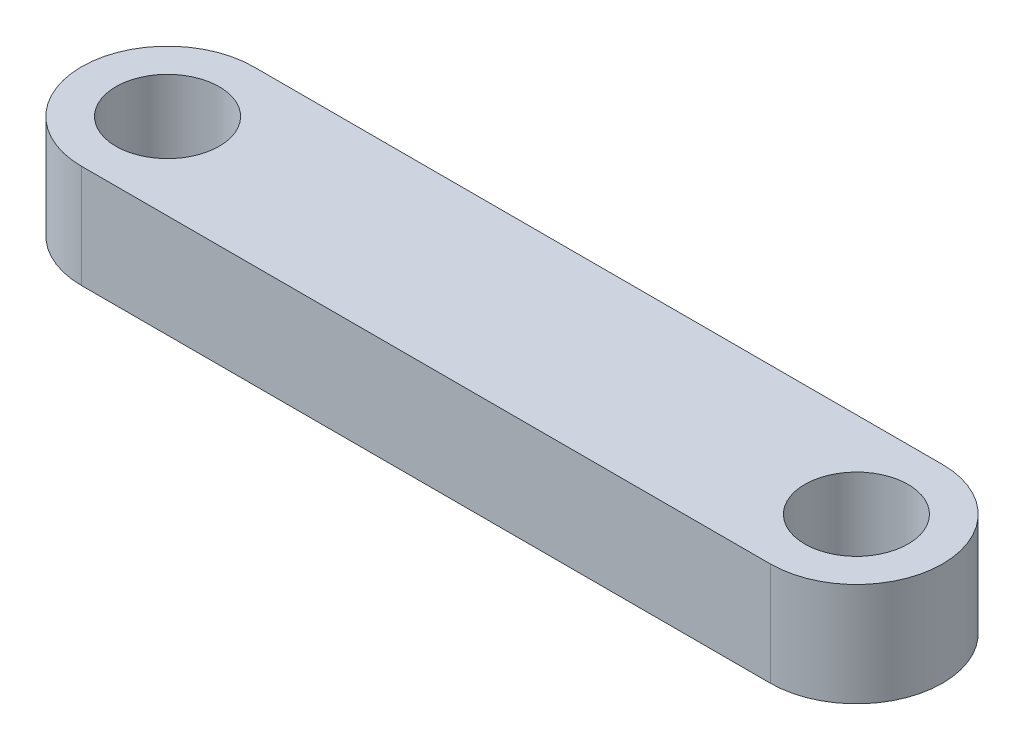
from build123d import *

# Parameters (mm, degrees)
CROQUIS1_R              = 1.5
SALIENTE_EXTRUIR1_DEPTH = 1.5


with BuildPart() as part:
    # Croquis1 → Saliente-Extruir1 (new, symmetric)
    with BuildSketch(Plane(origin=(0, 0, 0), x_dir=(1, 0, 0), z_dir=(0, 1, 0))):
        with BuildLine():
            Line((10, -2.5), (-10, -2.5))
            ThreePointArc((-10, -2.5), (-12.5, 0), (-10, 2.5))
            Line((-10, 2.5), (10, 2.5))
            ThreePointArc((10, 2.5), (12.5, 0), (10, -2.5))
        make_face()
        with Locations(Location((-10, 0, 0), (0, 0, 270))):
            Circle(CROQUIS1_R, mode=Mode.SUBTRACT)
        with Locations(Location((10, 0, 0), (0, 0, 270))):
            Circle(CROQUIS1_R, mode=Mode.SUBTRACT)
    extrude(amount=SALIENTE_EXTRUIR1_DEPTH, both=True)


solid = part.part
